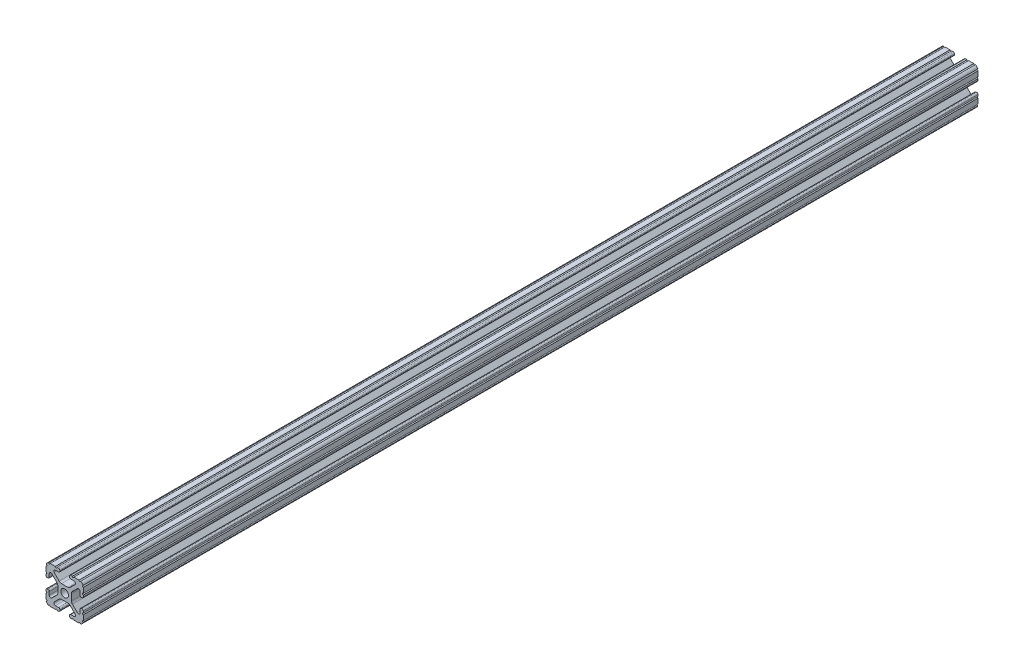
from build123d import *

# Parameters (mm, degrees)
SKETCH1_R           = 2.6035
BOSS_EXTRUDE1_DEPTH = 609.6


with BuildPart() as part:
    # Sketch1 → Boss-Extrude1 (new body)
    with BuildSketch(Plane.XY):
        with BuildLine():
            Line((-3.737334562, -5.299899128), (-7.103895736, -8.666460301))
            ThreePointArc((-7.103895736, -8.666460301), (-7.335478831, -9.830707141), (-6.348478019, -10.4902))
            Line((-6.348478019, -10.4902), (-4.190365, -10.4902))
            ThreePointArc((-4.190365, -10.4902), (-3.52627506, -10.76527506), (-3.2512, -11.429365))
            Line((-3.2512, -11.429365), (-3.2512, -11.760835))
            ThreePointArc((-3.2512, -11.760835), (-3.52627506, -12.42492494), (-4.190365, -12.7))
            Line((-4.190365, -12.7), (-5.243578019, -12.7))
            ThreePointArc((-5.243578019, -12.7), (-5.796028019, -12.14755), (-6.348478019, -12.7))
            Line((-6.348478019, -12.7), (-9.803703153, -12.7))
            ThreePointArc((-9.803703153, -12.7), (-10.295790179, -12.150857656), (-10.895412136, -12.579996867))
            ThreePointArc((-10.895412136, -12.579996867), (-11.943543586, -11.943543585), (-12.579996867, -10.895412135))
            ThreePointArc((-12.579996867, -10.895412135), (-12.150857661, -10.295790179), (-12.7, -9.803703154))
            Line((-12.7, -9.803703154), (-12.7, -6.348478019))
            ThreePointArc((-12.7, -6.348478019), (-12.14755, -5.796028019), (-12.7, -5.243578019))
            Line((-12.7, -5.243578019), (-12.7, -4.190365))
            ThreePointArc((-12.7, -4.190365), (-12.42492494, -3.52627506), (-11.760835, -3.2512))
            Line((-11.760835, -3.2512), (-11.429365, -3.2512))
            ThreePointArc((-11.429365, -3.2512), (-10.76527506, -3.52627506), (-10.4902, -4.190365))
            Line((-10.4902, -4.190365), (-10.4902, -6.348478019))
            ThreePointArc((-10.4902, -6.348478019), (-9.830707141, -7.335478831), (-8.666460302, -7.103895737))
            Line((-8.666460302, -7.103895737), (-5.299899128, -3.737334563))
            ThreePointArc((-5.299899128, -3.737334563), (-4.817571085, -3.015479635), (-4.6482, -2.163993691))
            Line((-4.6482, -2.163993691), (-4.6482, 2.16399369))
            ThreePointArc((-4.6482, 2.16399369), (-4.817571084, 3.015479634), (-5.299899127, 3.737334562))
            Line((-5.299899127, 3.737334562), (-8.666460301, 7.103895736))
            ThreePointArc((-8.666460301, 7.103895736), (-9.83070714, 7.335478831), (-10.490199999, 6.348478019))
            Line((-10.490199999, 6.348478019), (-10.490199999, 4.190365))
            ThreePointArc((-10.490199999, 4.190365), (-10.765275058, 3.52627506), (-11.429364999, 3.2512))
            Line((-11.429364999, 3.2512), (-11.760834999, 3.2512))
            ThreePointArc((-11.760834999, 3.2512), (-12.424924939, 3.52627506), (-12.699999999, 4.190365))
            Line((-12.699999999, 4.190365), (-12.699999999, 5.243578019))
            ThreePointArc((-12.699999999, 5.243578019), (-12.147549999, 5.796028019), (-12.699999999, 6.348478019))
            Line((-12.699999999, 6.348478019), (-12.699999999, 9.803703154))
            ThreePointArc((-12.699999999, 9.803703154), (-12.15085766, 10.295790179), (-12.579996866, 10.895412135))
            ThreePointArc((-12.579996866, 10.895412135), (-11.943543584, 11.943543586), (-10.895412134, 12.579996867))
            ThreePointArc((-10.895412134, 12.579996867), (-10.295790177, 12.150857661), (-9.803703152, 12.7))
            Line((-9.803703152, 12.7), (-6.348478018, 12.7))
            ThreePointArc((-6.348478018, 12.7), (-5.796028018, 12.14755), (-5.243578018, 12.7))
            Line((-5.243578018, 12.7), (-4.190364999, 12.7))
            ThreePointArc((-4.190364999, 12.7), (-3.526275058, 12.42492494), (-3.251199999, 11.760835))
            Line((-3.251199999, 11.760835), (-3.251199999, 11.429365))
            ThreePointArc((-3.251199999, 11.429365), (-3.526275058, 10.76527506), (-4.190364999, 10.4902))
            Line((-4.190364999, 10.4902), (-6.348478018, 10.4902))
            ThreePointArc((-6.348478018, 10.4902), (-7.33547883, 9.830707142), (-7.103895735, 8.666460303))
            Line((-7.103895735, 8.666460303), (-3.737334561, 5.299899129))
            ThreePointArc((-3.737334561, 5.299899129), (-3.015479634, 4.817571086), (-2.16399369, 4.6482))
            Line((-2.16399369, 4.6482), (2.163993692, 4.6482))
            ThreePointArc((2.163993692, 4.6482), (3.015479636, 4.817571085), (3.737334564, 5.299899128))
            Line((3.737334564, 5.299899128), (7.103895738, 8.666460302))
            ThreePointArc((7.103895738, 8.666460302), (7.335478833, 9.830707141), (6.348478021, 10.4902))
            Line((6.348478021, 10.4902), (4.190365002, 10.4902))
            ThreePointArc((4.190365002, 10.4902), (3.526275062, 10.76527506), (3.251200002, 11.429365))
            Line((3.251200002, 11.429365), (3.251200002, 11.760835))
            ThreePointArc((3.251200002, 11.760835), (3.526275062, 12.42492494), (4.190365002, 12.7))
            Line((4.190365002, 12.7), (5.243578021, 12.7))
            ThreePointArc((5.243578021, 12.7), (5.796028021, 12.14755), (6.348478021, 12.7))
            Line((6.348478021, 12.7), (9.803703155, 12.7))
            ThreePointArc((9.803703155, 12.7), (10.295790181, 12.150857656), (10.895412138, 12.579996867))
            ThreePointArc((10.895412138, 12.579996867), (11.943543588, 11.943543585), (12.579996869, 10.895412136))
            ThreePointArc((12.579996869, 10.895412136), (12.150857663, 10.295790179), (12.700000001, 9.803703154))
            Line((12.700000001, 9.803703154), (12.700000001, 6.34847802))
            ThreePointArc((12.700000001, 6.34847802), (12.147550001, 5.79602802), (12.700000001, 5.24357802))
            Line((12.700000001, 5.24357802), (12.700000001, 4.190365001))
            ThreePointArc((12.700000001, 4.190365001), (12.424924941, 3.526275061), (11.760835001, 3.251200001))
            Line((11.760835001, 3.251200001), (11.429365001, 3.251200001))
            ThreePointArc((11.429365001, 3.251200001), (10.765275061, 3.526275061), (10.490200001, 4.190365001))
            Line((10.490200001, 4.190365001), (10.490200001, 6.34847802))
            ThreePointArc((10.490200001, 6.34847802), (9.830707143, 7.335478832), (8.666460303, 7.103895738))
            Line((8.666460303, 7.103895738), (5.299899129, 3.737334564))
            ThreePointArc((5.299899129, 3.737334564), (4.817571086, 3.015479636), (4.648200001, 2.163993692))
            Line((4.648200001, 2.163993692), (4.648200001, -2.163993689))
            ThreePointArc((4.648200001, -2.163993689), (4.817571086, -3.015479633), (5.299899128, -3.737334561))
            Line((5.299899128, -3.737334561), (8.666460302, -7.103895735))
            ThreePointArc((8.666460302, -7.103895735), (9.830707141, -7.33547883), (10.4902, -6.348478018))
            Line((10.4902, -6.348478018), (10.4902, -4.190364999))
            ThreePointArc((10.4902, -4.190364999), (10.76527506, -3.526275059), (11.429365, -3.251199999))
            Line((11.429365, -3.251199999), (11.760835, -3.251199999))
            ThreePointArc((11.760835, -3.251199999), (12.42492494, -3.526275059), (12.7, -4.190364999))
            Line((12.7, -4.190364999), (12.7, -5.243578018))
            ThreePointArc((12.7, -5.243578018), (12.14755, -5.796028018), (12.7, -6.348478018))
            Line((12.7, -6.348478018), (12.7, -9.803703153))
            ThreePointArc((12.7, -9.803703153), (12.150857661, -10.295790178), (12.579996867, -10.895412134))
            ThreePointArc((12.579996867, -10.895412134), (11.943543586, -11.943543584), (10.895412136, -12.579996866))
            ThreePointArc((10.895412136, -12.579996866), (10.295790179, -12.150857655), (9.803703154, -12.699999999))
            Line((9.803703154, -12.699999999), (6.348478019, -12.699999999))
            ThreePointArc((6.348478019, -12.699999999), (5.796028019, -12.147549999), (5.243578019, -12.699999999))
            Line((5.243578019, -12.699999999), (4.190365, -12.699999999))
            ThreePointArc((4.190365, -12.699999999), (3.52627506, -12.424924939), (3.2512, -11.760834999))
            Line((3.2512, -11.760834999), (3.2512, -11.429364999))
            ThreePointArc((3.2512, -11.429364999), (3.52627506, -10.765275059), (4.190365, -10.490199999))
            Line((4.190365, -10.490199999), (6.348478019, -10.490199999))
            ThreePointArc((6.348478019, -10.490199999), (7.335478831, -9.830707141), (7.103895737, -8.666460301))
            Line((7.103895737, -8.666460301), (3.737334563, -5.299899128))
            ThreePointArc((3.737334563, -5.299899128), (3.015479635, -4.817571085), (2.163993691, -4.648199999))
            Line((2.163993691, -4.648199999), (-2.163993691, -4.648199999))
            ThreePointArc((-2.163993691, -4.648199999), (-3.015479635, -4.817571085), (-3.737334562, -5.299899128))
        make_face()
        with Locations(Location((0, 0, 0), (0, 0, 180))):
            Circle(SKETCH1_R, mode=Mode.SUBTRACT)
    extrude(amount=BOSS_EXTRUDE1_DEPTH)


solid = part.part
